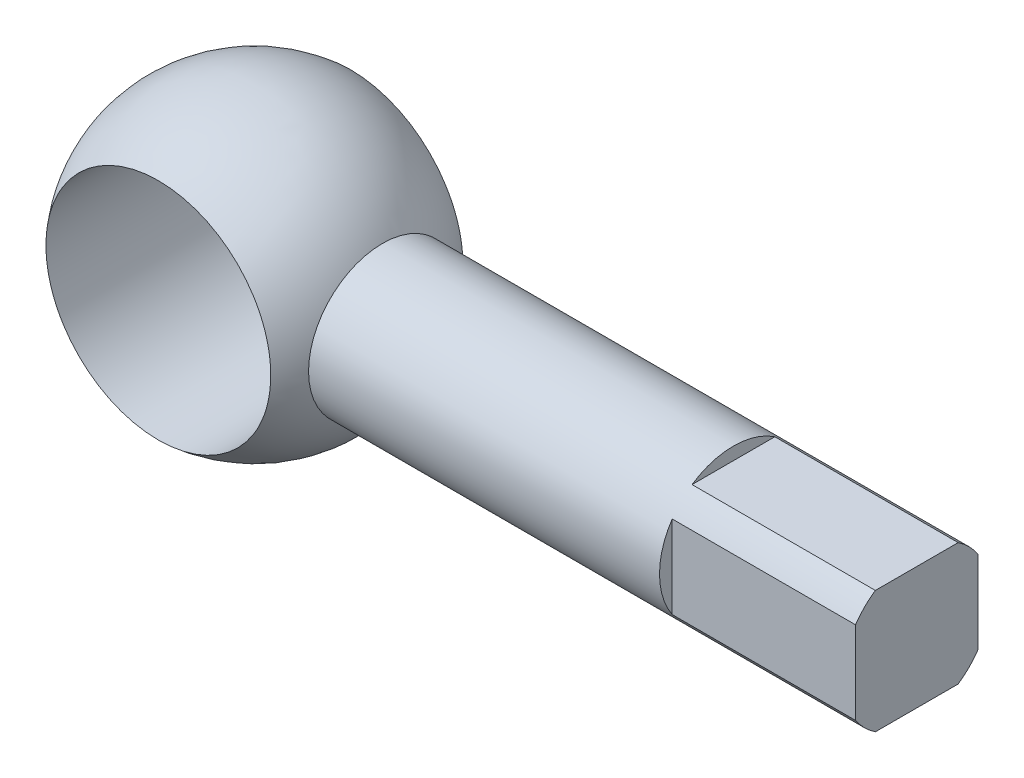
from build123d import *

# Parameters (mm, degrees)
CUT_EXTRUDE1_DEPTH      = 118.447860772
CUT_EXTRUDE1_DEPTH_BACK = 118.447860772
SKETCH2_R               = 19
CUT_EXTRUDE3_START      = -31
CUT_EXTRUDE3_DEPTH      = 172.206989852
CIRPATTERN1_COUNT       = 4


with BuildPart() as part:
    # Sketch1 → Revolve1 (revolve)
    with BuildSketch(Plane.XY):
        with BuildLine():
            Line((-25, 0), (112, 0))
            Line((112, 0), (112, 12.5))
            Line((112, 12.5), (21.650635095, 12.5))
            ThreePointArc((21.650635095, 12.5), (-6.470476128, 24.148145657), (-25, 0))
        make_face()
    revolve(axis=Axis((-25, 0, 0), (1, 0, 0)))

    # Sketch2 → Cut-Extrude1 (cut, two sides: drawn at the far end of the back side and taken through both)
    with BuildSketch(Plane.XY.offset(-CUT_EXTRUDE1_DEPTH_BACK)):
        Circle(SKETCH2_R)
    extrude(amount=CUT_EXTRUDE1_DEPTH + CUT_EXTRUDE1_DEPTH_BACK, mode=Mode.SUBTRACT)

    # Sketch4 → Cut-Extrude3 (cut)
    with BuildSketch(Plane(origin=(112, 0, 0), x_dir=(0, 0, -1), z_dir=(1, 0, 0)).offset(CUT_EXTRUDE3_START)):
        with BuildLine():
            Line((-7, 10.356157589), (7, 10.356157589))
            ThreePointArc((7, 10.356157589), (0, 12.5), (-7, 10.356157589))
        make_face()
    cut_extrude3 = extrude(amount=CUT_EXTRUDE3_DEPTH, mode=Mode.SUBTRACT)

    # CirPattern1: Cut-Extrude3 ×4 about axis
    cirpattern1_axis = Axis((0, 0, 0), (1, 0, 0))
    for i in range(1, CIRPATTERN1_COUNT):
        add(cut_extrude3.rotate(cirpattern1_axis, i * 360 / CIRPATTERN1_COUNT), mode=Mode.SUBTRACT)


solid = part.part
